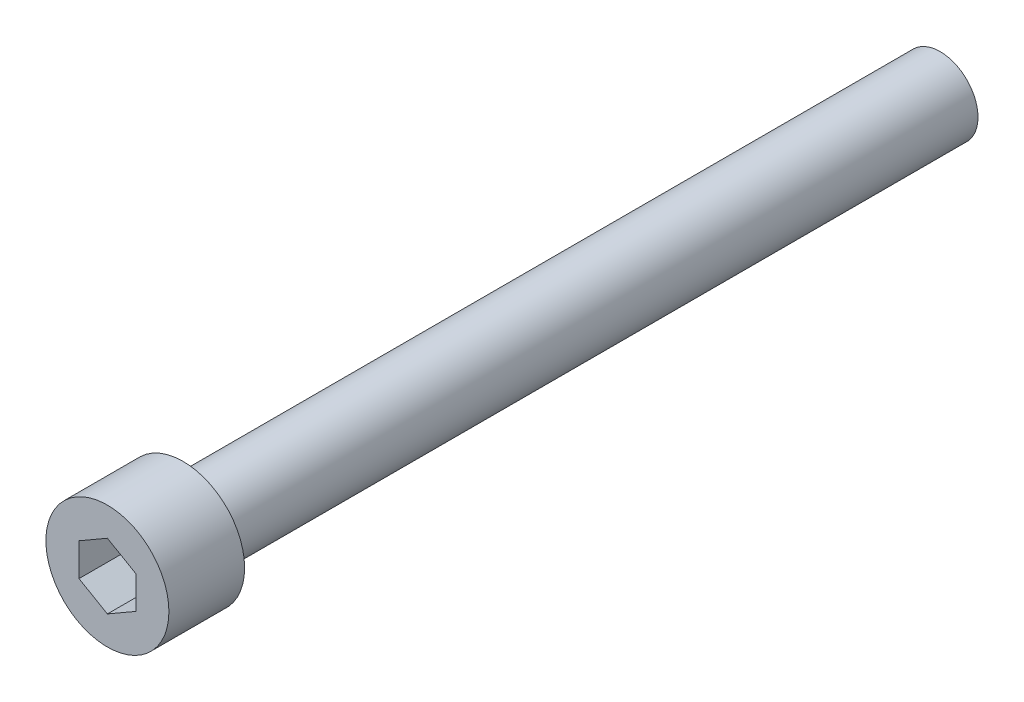
from build123d import *

# Parameters (mm, degrees)
WYTNIJ_WYCI_GNI_CIE1_DEPTH = 6


with BuildPart() as part:
    # Szkic1 → Obrót1 (revolve)
    with BuildSketch(Plane(origin=(0, 0, 0), x_dir=(0, 0, -1), z_dir=(1, 0, 0)), mode=Mode.PRIVATE) as obr_t1_sk:
        Polygon((0, 0), (0, 6.5), (8, 6.5), (8, 4), (88, 4), (88, 0), align=None)
    revolve(obr_t1_sk.sketch.rotate(Axis((0, 0, 0), (0, 0, -1)), 90), axis=Axis((0, 0, 0), (0, 0, -1)))

    # Szkic2 → Wytnij-wyciągnięcie1 (cut)
    with BuildSketch(Plane.XY):
        Polygon((-3, -1.732050808), (0, -3.464101615), (3, -1.732050808), (3, 1.732050808), (0, 3.464101615), (-3, 1.732050808), align=None)
    extrude(amount=-WYTNIJ_WYCI_GNI_CIE1_DEPTH, mode=Mode.SUBTRACT)


solid = part.part
